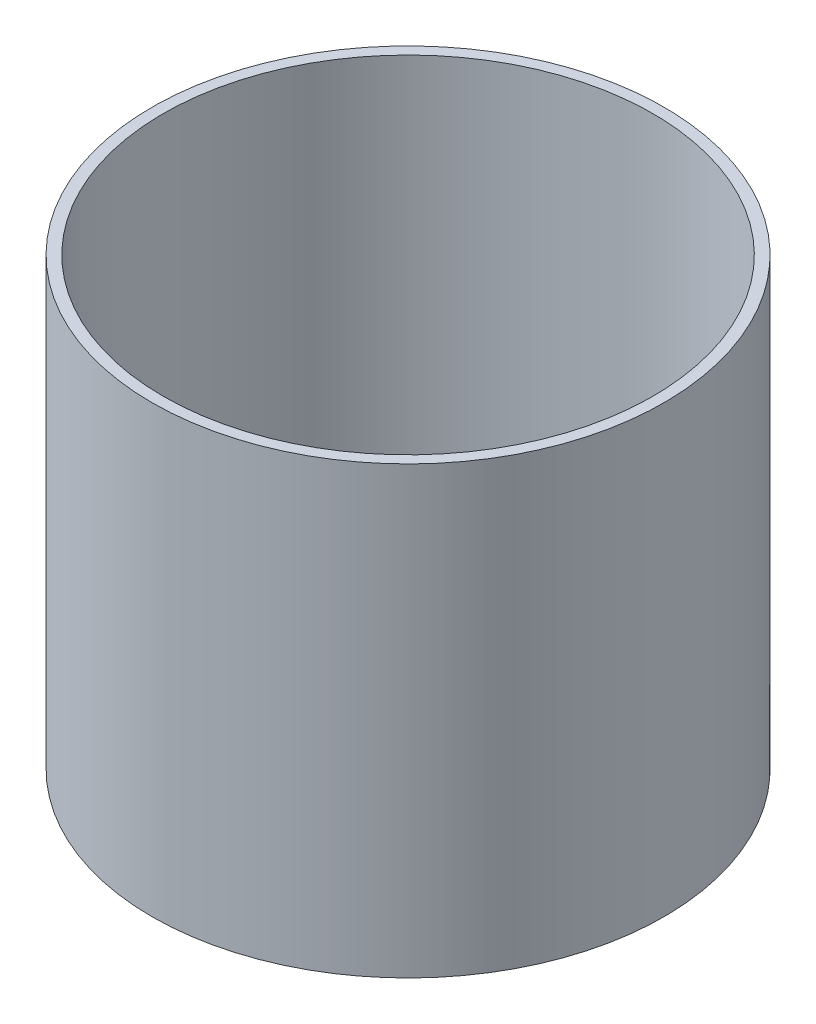
from build123d import *

# Parameters (mm, degrees)
SKETCH1_R           = 23
SKETCH1_R_2         = 22
BOSS_EXTRUDE1_DEPTH = 40


with BuildPart() as part:
    # Sketch1 → Boss-Extrude1 (new body)
    with BuildSketch(Plane(origin=(0, 0, 0), x_dir=(1, 0, 0), z_dir=(0, 1, 0))):
        with Locations(Location((0, 0, 0), (0, 0, 270))):
            Circle(SKETCH1_R)
        with Locations(Location((0, 0, 0), (0, 0, 270))):
            Circle(SKETCH1_R_2, mode=Mode.SUBTRACT)
    extrude(amount=BOSS_EXTRUDE1_DEPTH)


solid = part.part
